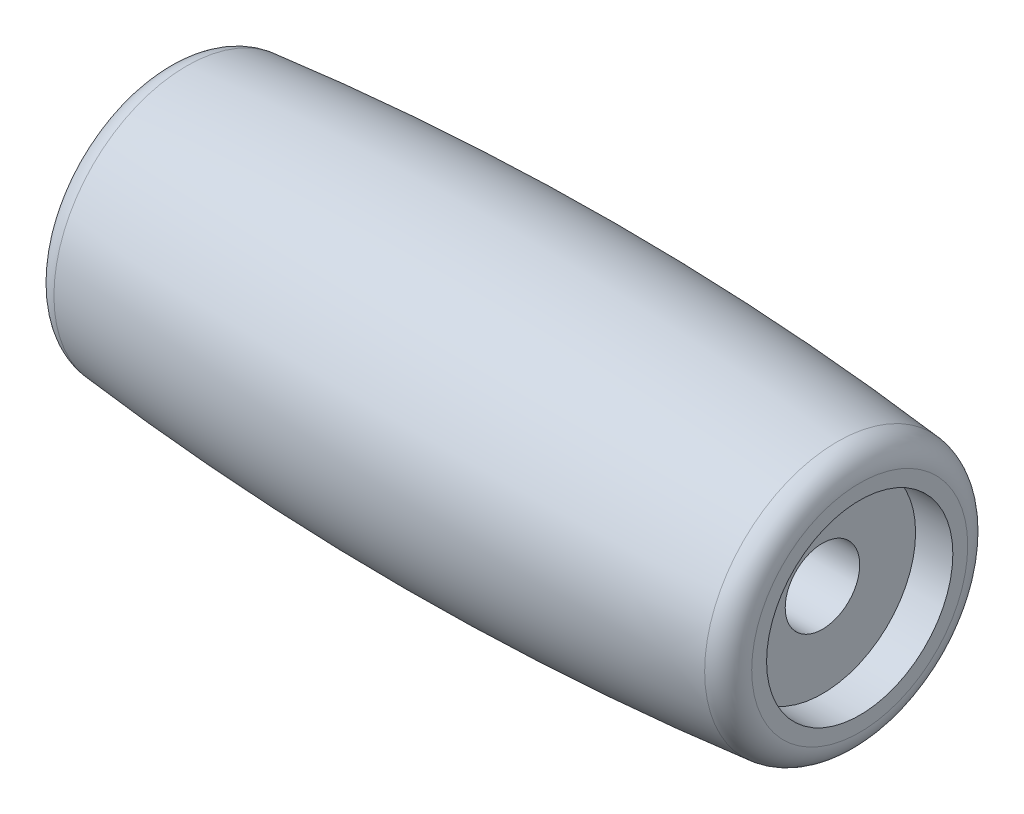
from build123d import *


with BuildPart() as part:
    # Sketch1 → Revolve1 (revolve)
    with BuildSketch(Plane.XY, mode=Mode.PRIVATE) as revolve1_sk:
        with BuildLine():
            Line((-12.5, 1.5), (12.5, 1.5))
            Line((12.5, 1.5), (12.5, 3.75))
            Line((12.5, 3.75), (14, 3.75))
            Line((14, 3.75), (14, 4.348576665))
            ThreePointArc((14, 4.348576665), (13.741609048, 5.019408999), (13.099967959, 5.343567322))
            ThreePointArc((13.099967959, 5.343567322), (0, 6), (-13.099967959, 5.343567322))
            ThreePointArc((-13.099967959, 5.343567322), (-13.741609048, 5.019408999), (-14, 4.348576665))
            Line((-14, 4.348576665), (-14, 3.75))
            Line((-14, 3.75), (-12.5, 3.75))
            Line((-12.5, 3.75), (-12.5, 1.5))
        make_face()
    revolve(revolve1_sk.sketch.rotate(Axis((0, 0, 0), (1, 0, 0)), 90), axis=Axis((0, 0, 0), (1, 0, 0)))


solid = part.part
